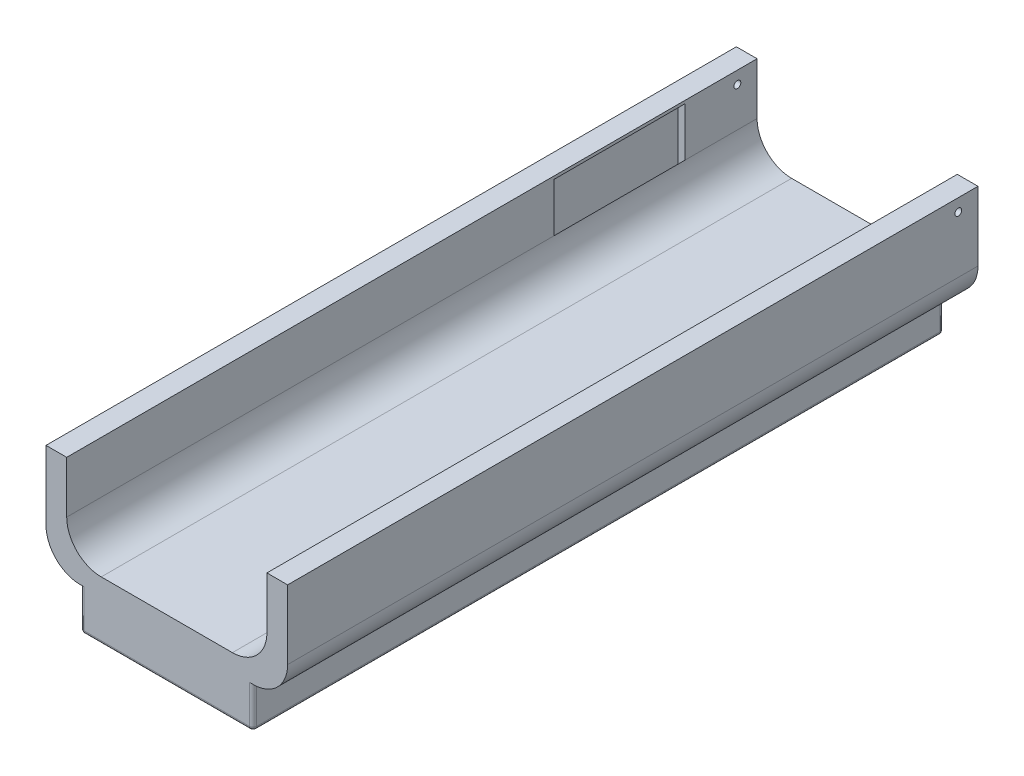
from build123d import *

# Parameters (mm, degrees)
BOSS_EXTRUDE1_DEPTH      = 200
FILLET1_R                = 10
SKETCH12_W               = 38
SKETCH12_H               = 17.8
CUT_EXTRUDE9_DEPTH       = 2
BOSS_EXTRUDE2_DEPTH      = 200
FILLET4_R                = 1
SKETCH17_W               = 44.239510651
SKETCH17_H               = 8.731521098
CUT_EXTRUDE11_DEPTH      = 193
CUT_EXTRUDE12_DEPTH      = 215.329567289
CUT_EXTRUDE12_DEPTH_BACK = 215.329567289
SKETCH20_R               = 1


with BuildPart() as part:
    # Sketch1 → Boss-Extrude1 (new body)
    with BuildSketch(Plane.XY):
        Polygon((-30.275246352, -0.908779536), (-30.275246352, -25.913082449), (27.724753648, -25.913082449), (27.724753648, -0.908779536), (33.724753648, -0.908779536), (33.724753648, -30.908779536), (-36.275246352, -30.908779536), (-36.275246352, -0.908779536), align=None)
    extrude(amount=BOSS_EXTRUDE1_DEPTH)

    # Fillet1
    fillet1_edges = [part.edges().sort_by_distance(p)[0] for p in [
        (-30.275246352, -25.913082449, 100),
        (27.724753648, -25.913082449, 100),
        (33.724753648, -30.908779536, 100),
        (-36.275246352, -30.908779536, 100),
    ]]
    fillet(fillet1_edges, radius=FILLET1_R)

    # Sketch12 → Cut-Extrude9 (cut)
    with BuildSketch(Plane(origin=(-30.275246352, 0, 0), x_dir=(0, 0, -1), z_dir=(1, 0, 0))):
        with Locations((-39.87, -10.658779536)):
            Rectangle(SKETCH12_W, SKETCH12_H)
    extrude(amount=-CUT_EXTRUDE9_DEPTH, mode=Mode.SUBTRACT)

    # Sketch15 → Boss-Extrude2 (add)
    with BuildSketch(Plane.XY):
        Polygon((-26.275246352, -30.908779536), (-26.275246352, -42.908779536), (23.724753648, -42.908779536), (23.724753648, -30.908779536), (20.724753648, -30.908779536), (-23.275246352, -30.908779536), align=None)
    extrude(amount=BOSS_EXTRUDE2_DEPTH)

    # Fillet4
    fillet4_edges = [part.edges().sort_by_distance(p)[0] for p in [
        (-26.275246352, -36.908779536, 0),
        (-26.275246352, -42.908779536, 100),
        (-1.275246352, -42.908779536, 0),
        (23.724753648, -42.908779536, 100),
        (23.724753648, -36.908779536, 0),
        (-26.275246352, -36.908779536, 200),
        (-1.275246352, -42.908779536, 200),
        (23.724753648, -36.908779536, 200),
    ]]
    fillet(fillet4_edges, radius=FILLET4_R)

    # Sketch17 → Cut-Extrude11 (cut)
    with BuildSketch(Plane(origin=(0, 0, 0), x_dir=(-1, 0, 0), z_dir=(0, 0, -1))):
        with Locations((1.300040019, -36.058148136)):
            Rectangle(SKETCH17_W, SKETCH17_H)
    extrude(amount=-CUT_EXTRUDE11_DEPTH, mode=Mode.SUBTRACT)

    # Sketch20 → Cut-Extrude12 (cut, two sides: drawn at the far end of the back side and taken through both)
    with BuildSketch(Plane.ZY.offset(-27.724753648).offset(-CUT_EXTRUDE12_DEPTH_BACK)):
        with Locations(Location((5.712078597, -4.528347047, 0), (0, 0, 270))):
            Circle(SKETCH20_R)
    extrude(amount=CUT_EXTRUDE12_DEPTH + CUT_EXTRUDE12_DEPTH_BACK, mode=Mode.SUBTRACT)


solid = part.part
